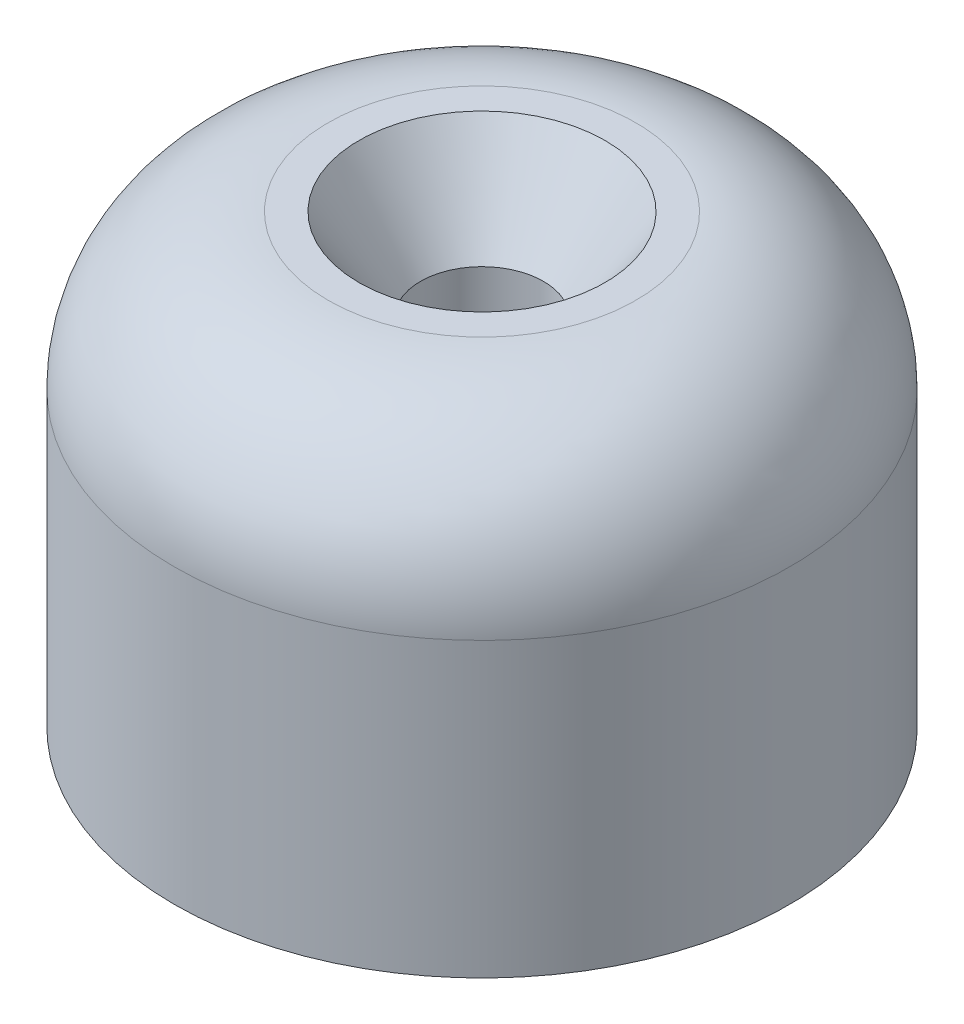
from build123d import *

# Parameters (mm, degrees)
SKETCH1_R           = 10
SKETCH1_R_2         = 2
BOSS_EXTRUDE1_DEPTH = 7.5
BOSS_EXTRUDE2_START = 7
SKETCH2_R           = 10
SKETCH2_R_2         = 4.125
BOSS_EXTRUDE2_DEPTH = 7
SKETCH3_R           = 4
CUT_EXTRUDE1_DEPTH  = 3
CUT_EXTRUDE1_DRAFT  = -34
FILLET1_R           = 5
FILLET2_R           = 1


with BuildPart() as part:
    # Sketch1 → Boss-Extrude1 (new body)
    with BuildSketch(Plane(origin=(0, 0, 0), x_dir=(1, 0, 0), z_dir=(0, 1, 0))):
        with Locations(Location((0, 0, 0), (0, 0, 270))):
            Circle(SKETCH1_R)
        with Locations(Location((0, 0, 0), (0, 0, 270))):
            Circle(SKETCH1_R_2, mode=Mode.SUBTRACT)
    extrude(amount=BOSS_EXTRUDE1_DEPTH)

    # Sketch2 → Boss-Extrude2 (add)
    with BuildSketch(Plane.XZ.offset(BOSS_EXTRUDE2_START)):
        with Locations(Location((0, 0, 0), (0, 0, 270))):
            Circle(SKETCH2_R)
        with Locations(Location((0, 0, 0), (0, 0, 270))):
            Circle(SKETCH2_R_2, mode=Mode.SUBTRACT)
    extrude(amount=-BOSS_EXTRUDE2_DEPTH)


with BuildPart() as cut_extrude1_tool:
    # Sketch3 → Cut-Extrude1 (with draft: the straight prism first)
    with BuildSketch(Plane(origin=(0, 7.5, 0), x_dir=(1, 0, 0), z_dir=(0, 1, 0))):
        Circle(SKETCH3_R)
    extrude(amount=-CUT_EXTRUDE1_DEPTH)
    # Cut-Extrude1: the draft: its side faces are tilted about the plane it starts from
    cut_extrude1_sides = [cut_extrude1_tool.faces().sort_by_distance(p)[0] for p in [
        (-4, 6, 0),
    ]]
    draft(cut_extrude1_sides, Plane(origin=(0, 7.5, 0), x_dir=(1, 0, 0), z_dir=(0, 1, 0)), CUT_EXTRUDE1_DRAFT)


with BuildPart() as part_1:
    add(part.part)

    # Cut-Extrude1: cut by cut_extrude1_tool
    add(cut_extrude1_tool.part, mode=Mode.SUBTRACT)

    # Fillet1
    fillet1_edges = [part_1.edges().sort_by_distance(p)[0] for p in [
        (0, 7.5, -10),
    ]]
    fillet(fillet1_edges, radius=FILLET1_R)

    # Fillet2
    fillet2_edges = [part_1.edges().sort_by_distance(p)[0] for p in [
        (0, -7, 4.125),
    ]]
    fillet(fillet2_edges, radius=FILLET2_R)


solid = part_1.part
